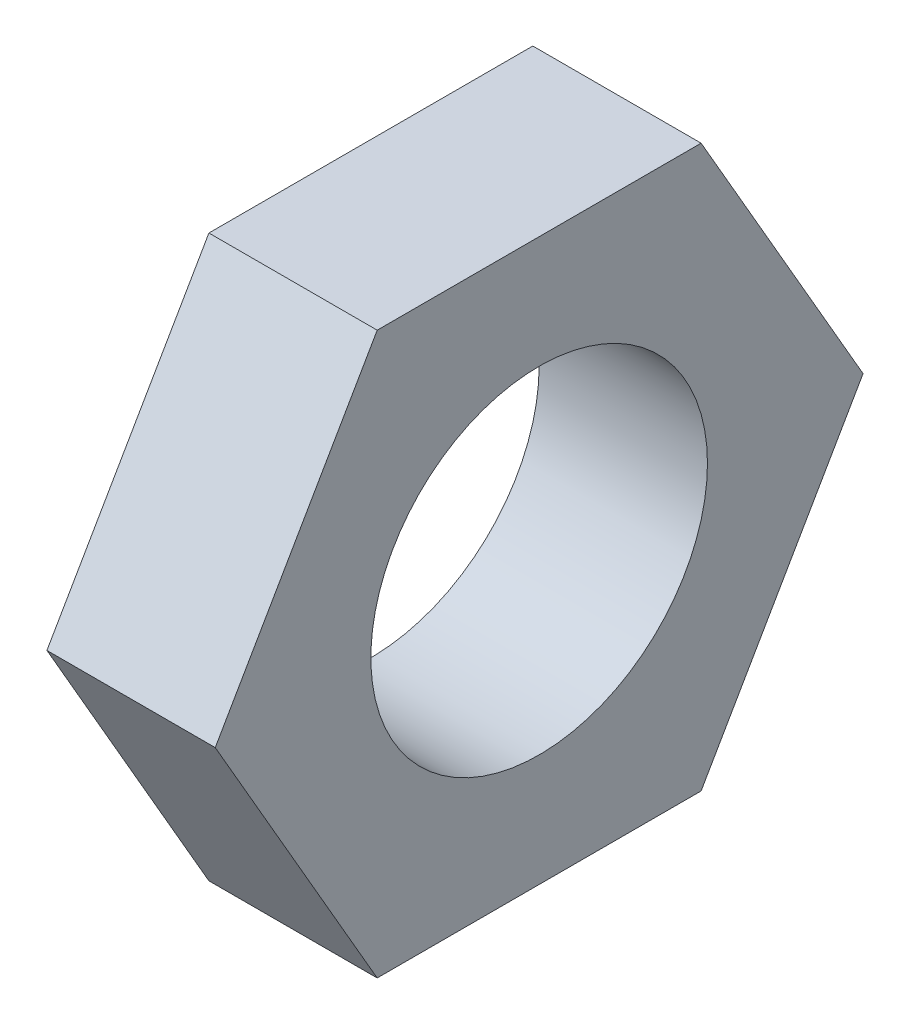
from build123d import *

# Parameters (mm, degrees)
HEX_NUT_BLANK_DEPTH         = 3
M6_THREAD_ENVELOPE_SKETCH_R = 3
M6_THREAD_ENVELOPE_DEPTH    = 3.2


with BuildPart() as part:
    # Hex nut blank sketch → Hex nut blank (new body)
    with BuildSketch(Plane(origin=(20.5, 0, 0), x_dir=(0, 0, -1), z_dir=(1, 0, 0))):
        Polygon((16.613248654, -24), (13.726497308, -29), (16.613248654, -34), (22.386751346, -34), (25.273502692, -29), (22.386751346, -24), align=None)
    extrude(amount=HEX_NUT_BLANK_DEPTH)

    # M6 thread envelope sketch → M6 thread envelope (cut)
    with BuildSketch(Plane(origin=(20.4, 0, 0), x_dir=(0, 0, -1), z_dir=(1, 0, 0))):
        with Locations((19.5, -29)):
            Circle(M6_THREAD_ENVELOPE_SKETCH_R)
    extrude(amount=M6_THREAD_ENVELOPE_DEPTH, mode=Mode.SUBTRACT)


solid = part.part
